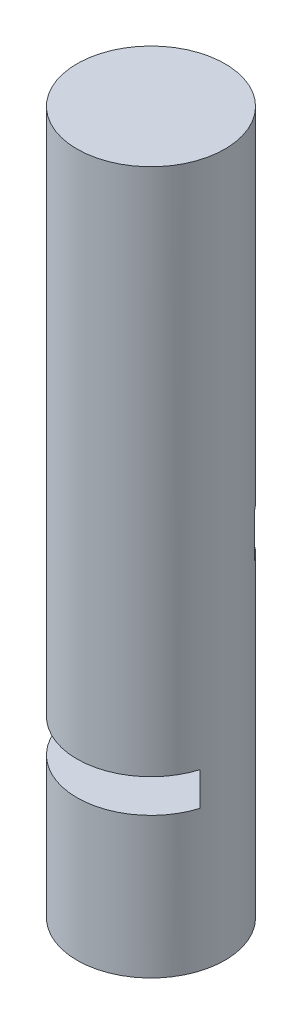
from build123d import *

# Parameters (mm, degrees)
SKETCH1_R           = 42
BOSS_EXTRUDE1_DEPTH = 80
SKETCH7_R           = 42
BOSS_EXTRUDE2_DEPTH = 19
SKETCH8_R           = 40.2
BATTERY_SLOT_DEPTH  = 19
SKETCH10_W          = 80.3
SKETCH10_H          = 67
CUT_EXTRUDE6_DEPTH  = 19
SKETCH11_R          = 42
BOSS_EXTRUDE3_DEPTH = 20
SKETCH12_R          = 42
BOSS_EXTRUDE4_DEPTH = 50
SKETCH13_R          = 40.2
CUT_EXTRUDE7_DEPTH  = 50
SKETCH14_R          = 42
BOSS_EXTRUDE5_DEPTH = 35
SKETCH15_R          = 40.2
RPI_SLOT_DEPTH      = 25
SKETCH16_W          = 68
SKETCH16_H          = 64
CUT_EXTRUDE9_DEPTH  = 25
SKETCH17_R          = 42
BOSS_EXTRUDE6_DEPTH = 20
SKETCH18_R          = 42
BOSS_EXTRUDE7_DEPTH = 175


with BuildPart() as part:
    # Sketch1 → Boss-Extrude1 (new body)
    with BuildSketch(Plane(origin=(0, 0, 0), x_dir=(1, 0, 0), z_dir=(0, 1, 0))):
        Circle(SKETCH1_R)
    extrude(amount=BOSS_EXTRUDE1_DEPTH)

    # Sketch7 → Boss-Extrude2 (add)
    with BuildSketch(Plane(origin=(0, 80, 0), x_dir=(1, 0, 0), z_dir=(0, 1, 0))):
        Circle(SKETCH7_R)
    extrude(amount=BOSS_EXTRUDE2_DEPTH)

    # Sketch8 → Battery slot (cut)
    with BuildSketch(Plane(origin=(0, 99, 0), x_dir=(1, 0, 0), z_dir=(0, 1, 0))):
        Circle(SKETCH8_R)
    extrude(amount=-BATTERY_SLOT_DEPTH, mode=Mode.SUBTRACT)

    # Sketch10 → Cut-Extrude6 (cut)
    with BuildSketch(Plane(origin=(0, 99, 0), x_dir=(1, 0, 0), z_dir=(0, 1, 0))):
        with Locations((0, -31.495629775)):
            Rectangle(SKETCH10_W, SKETCH10_H)
    extrude(amount=-CUT_EXTRUDE6_DEPTH, mode=Mode.SUBTRACT)

    # Sketch11 → Boss-Extrude3 (add)
    with BuildSketch(Plane(origin=(0, 99, 0), x_dir=(1, 0, 0), z_dir=(0, 1, 0))):
        Circle(SKETCH11_R)
    extrude(amount=BOSS_EXTRUDE3_DEPTH)

    # Sketch12 → Boss-Extrude4 (add)
    with BuildSketch(Plane(origin=(0, 119, 0), x_dir=(1, 0, 0), z_dir=(0, 1, 0))):
        Circle(SKETCH12_R)
    extrude(amount=BOSS_EXTRUDE4_DEPTH)

    # Sketch13 → Cut-Extrude7 (cut)
    with BuildSketch(Plane(origin=(0, 169, 0), x_dir=(1, 0, 0), z_dir=(0, 1, 0))):
        Circle(SKETCH13_R)
    extrude(amount=-CUT_EXTRUDE7_DEPTH, mode=Mode.SUBTRACT)

    # Sketch14 → Boss-Extrude5 (add)
    with BuildSketch(Plane(origin=(0, 169, 0), x_dir=(1, 0, 0), z_dir=(0, 1, 0))):
        Circle(SKETCH14_R)
    extrude(amount=BOSS_EXTRUDE5_DEPTH)

    # Sketch15 → RPI Slot (cut)
    with BuildSketch(Plane(origin=(0, 204, 0), x_dir=(1, 0, 0), z_dir=(0, 1, 0))):
        Circle(SKETCH15_R)
    extrude(amount=-RPI_SLOT_DEPTH, mode=Mode.SUBTRACT)

    # Sketch16 → Cut-Extrude9 (cut)
    with BuildSketch(Plane(origin=(0, 204, 0), x_dir=(1, 0, 0), z_dir=(0, 1, 0))):
        with Locations((0, 18)):
            Rectangle(SKETCH16_W, SKETCH16_H)
    extrude(amount=-CUT_EXTRUDE9_DEPTH, mode=Mode.SUBTRACT)

    # Sketch17 → Boss-Extrude6 (add)
    with BuildSketch(Plane(origin=(0, 204, 0), x_dir=(1, 0, 0), z_dir=(0, 1, 0))):
        Circle(SKETCH17_R)
    extrude(amount=BOSS_EXTRUDE6_DEPTH)

    # Sketch18 → Boss-Extrude7 (add)
    with BuildSketch(Plane(origin=(0, 224, 0), x_dir=(1, 0, 0), z_dir=(0, 1, 0))):
        Circle(SKETCH18_R)
    extrude(amount=BOSS_EXTRUDE7_DEPTH)


solid = part.part
